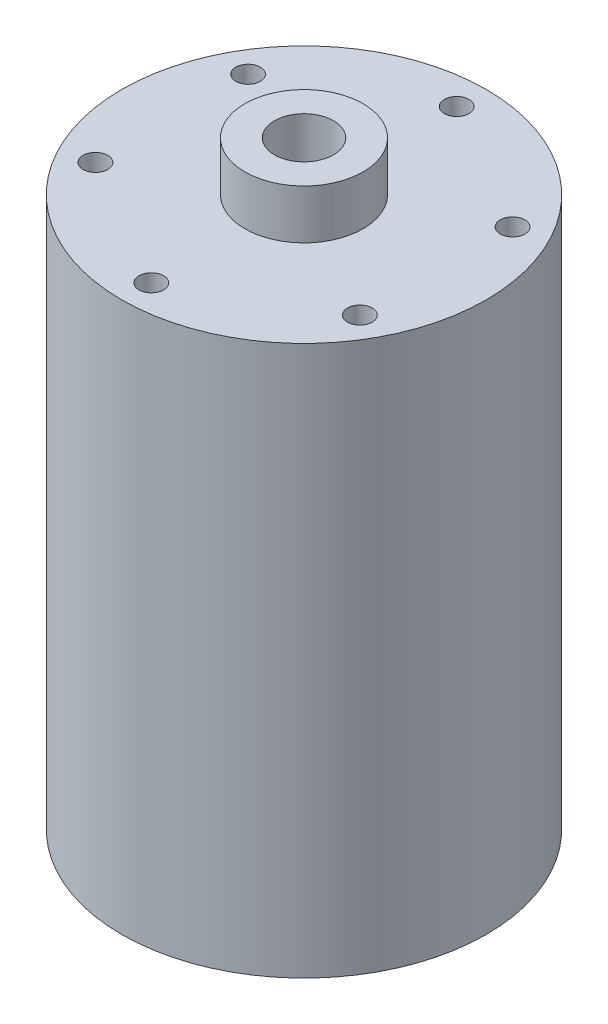
from build123d import *

# Parameters (mm, degrees)
SKETCH1_R                 = 18.5
BOSS_EXTRUDE1_DEPTH       = 55.8
SKETCH2_R                 = 6
BOSS_EXTRUDE2_DEPTH       = 5
M3X0_5_TAPPED_HOLE1_D     = 2.5
M3X0_5_TAPPED_HOLE1_DEPTH = 10.67
M3X0_5_TAPPED_HOLE1_TIP   = 0.751075774
SKETCH8_R                 = 3
CUT_EXTRUDE1_DEPTH        = 5


with BuildPart() as part:
    # Sketch1 → Boss-Extrude1 (new body)
    with BuildSketch(Plane(origin=(0, 0, 0), x_dir=(1, 0, 0), z_dir=(0, 1, 0))):
        with Locations(Location((0, 0, 0), (0, 0, 270))):
            Circle(SKETCH1_R)
    extrude(amount=BOSS_EXTRUDE1_DEPTH)

    # Sketch2 → Boss-Extrude2 (add)
    with BuildSketch(Plane(origin=(0, 55.8, 0), x_dir=(1, 0, 0), z_dir=(0, 1, 0))):
        with Locations(Location((0, 0, 0), (0, 0, 270))):
            Circle(SKETCH2_R)
    extrude(amount=BOSS_EXTRUDE2_DEPTH)

    # M3x0.5 Tapped Hole1
    with Locations(Plane(origin=(0, 55.8, 0), x_dir=(1, 0, 0), z_dir=(0, 1, 0))):
        with Locations((0, 15.5), (13.423393759, 7.75), (13.423393759, -7.75), (0, -15.5), (-13.423393759, -7.75), (-13.423393759, 7.75)):
            Hole(M3X0_5_TAPPED_HOLE1_D / 2, depth=M3X0_5_TAPPED_HOLE1_DEPTH)
            with Locations((0, 0, -(M3X0_5_TAPPED_HOLE1_DEPTH + M3X0_5_TAPPED_HOLE1_TIP / 2))):  # 118° drill point
                Cone(0, M3X0_5_TAPPED_HOLE1_D / 2, M3X0_5_TAPPED_HOLE1_TIP, mode=Mode.SUBTRACT)

    # Sketch8 → Cut-Extrude1 (cut)
    with BuildSketch(Plane(origin=(0, 60.8, 0), x_dir=(1, 0, 0), z_dir=(0, 1, 0))):
        with Locations(Location((0, 0, 0), (0, 0, 270))):
            Circle(SKETCH8_R)
    extrude(amount=-CUT_EXTRUDE1_DEPTH, mode=Mode.SUBTRACT)


solid = part.part
